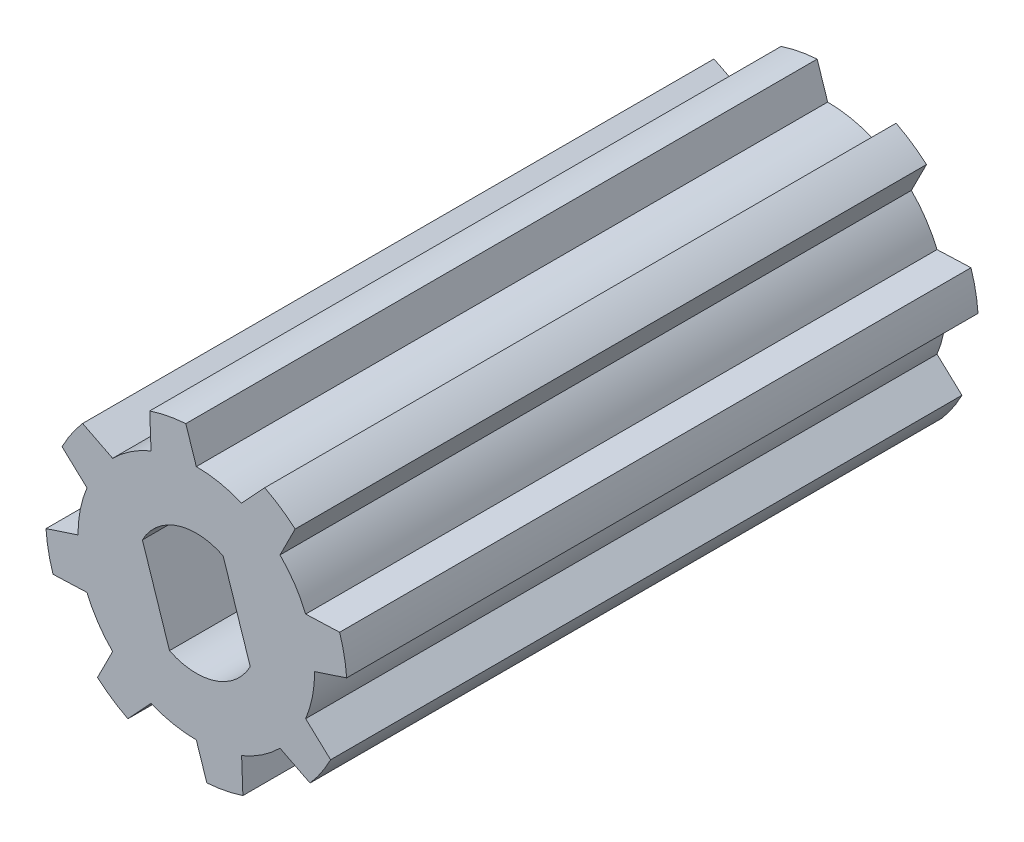
from build123d import *

# Parameters (mm, degrees)
BOSS_EXTRUDE1_DEPTH = 26


with BuildPart() as part:
    # Sketch1 → Boss-Extrude1 (new body)
    with BuildSketch(Plane.XY.offset(26)):
        with BuildLine():
            Line((4.873707659, 0), (6.190281068, 0.43286662))
            ThreePointArc((6.190281068, 0.43286662), (6.091386481, 1.184045587), (5.901683351, 1.917573162))
            Line((5.901683351, 1.917573162), (4.502718754, 1.865087175))
            ThreePointArc((4.502718754, 1.865087175), (4.052339818, 2.7076869), (3.446231735, 3.446231735))
            Line((3.446231735, 3.446231735), (4.071106798, 4.683272643))
            ThreePointArc((4.071106798, 4.683272643), (3.470014023, 5.144507351), (2.817191332, 5.529049304))
            Line((2.817191332, 5.529049304), (1.865087175, 4.502718754))
            ThreePointArc((1.865087175, 4.502718754), (0.950813197, 4.780060733), (0, 4.873707659))
            Line((0, 4.873707659), (-0.43286662, 6.190281068))
            ThreePointArc((-0.43286662, 6.190281068), (-1.184045587, 6.091386481), (-1.917573162, 5.901683351))
            Line((-1.917573162, 5.901683351), (-1.865087175, 4.502718754))
            ThreePointArc((-1.865087175, 4.502718754), (-2.7076869, 4.052339818), (-3.446231735, 3.446231735))
            Line((-3.446231735, 3.446231735), (-4.683272643, 4.071106798))
            ThreePointArc((-4.683272643, 4.071106798), (-5.144507351, 3.470014023), (-5.529049304, 2.817191332))
            Line((-5.529049304, 2.817191332), (-4.502718754, 1.865087175))
            ThreePointArc((-4.502718754, 1.865087175), (-4.780060733, 0.950813197), (-4.873707659, 0))
            Line((-4.873707659, 0), (-6.190281068, -0.43286662))
            ThreePointArc((-6.190281068, -0.43286662), (-6.091386481, -1.184045587), (-5.901683351, -1.917573162))
            Line((-5.901683351, -1.917573162), (-4.502718754, -1.865087175))
            ThreePointArc((-4.502718754, -1.865087175), (-4.052339818, -2.7076869), (-3.446231735, -3.446231735))
            Line((-3.446231735, -3.446231735), (-4.071106798, -4.683272643))
            ThreePointArc((-4.071106798, -4.683272643), (-3.470014023, -5.144507351), (-2.817191332, -5.529049304))
            Line((-2.817191332, -5.529049304), (-1.865087175, -4.502718754))
            ThreePointArc((-1.865087175, -4.502718754), (-0.950813197, -4.780060733), (0, -4.873707659))
            Line((0, -4.873707659), (0.43286662, -6.190281068))
            ThreePointArc((0.43286662, -6.190281068), (1.184045587, -6.091386481), (1.917573162, -5.901683351))
            Line((1.917573162, -5.901683351), (1.865087175, -4.502718754))
            ThreePointArc((1.865087175, -4.502718754), (2.7076869, -4.052339818), (3.446231735, -3.446231735))
            Line((3.446231735, -3.446231735), (4.683272643, -4.071106798))
            ThreePointArc((4.683272643, -4.071106798), (5.144507351, -3.470014023), (5.529049304, -2.817191332))
            Line((5.529049304, -2.817191332), (4.502718754, -1.865087175))
            ThreePointArc((4.502718754, -1.865087175), (4.780060733, -0.950813197), (4.873707659, 0))
        make_face()
        with BuildLine():
            Line((1.104822787, 2.242624937), (2.220079912, -1.149454299))
            ThreePointArc((2.220079912, -1.149454299), (0.78083617, -2.374930499), (-1.104822787, -2.242624937))
            Line((-1.104822787, -2.242624937), (-2.220079912, 1.149454299))
            ThreePointArc((-2.220079912, 1.149454299), (-0.78083617, 2.374930499), (1.104822787, 2.242624937))
        make_face(mode=Mode.SUBTRACT)
    extrude(amount=-BOSS_EXTRUDE1_DEPTH)


solid = part.part
